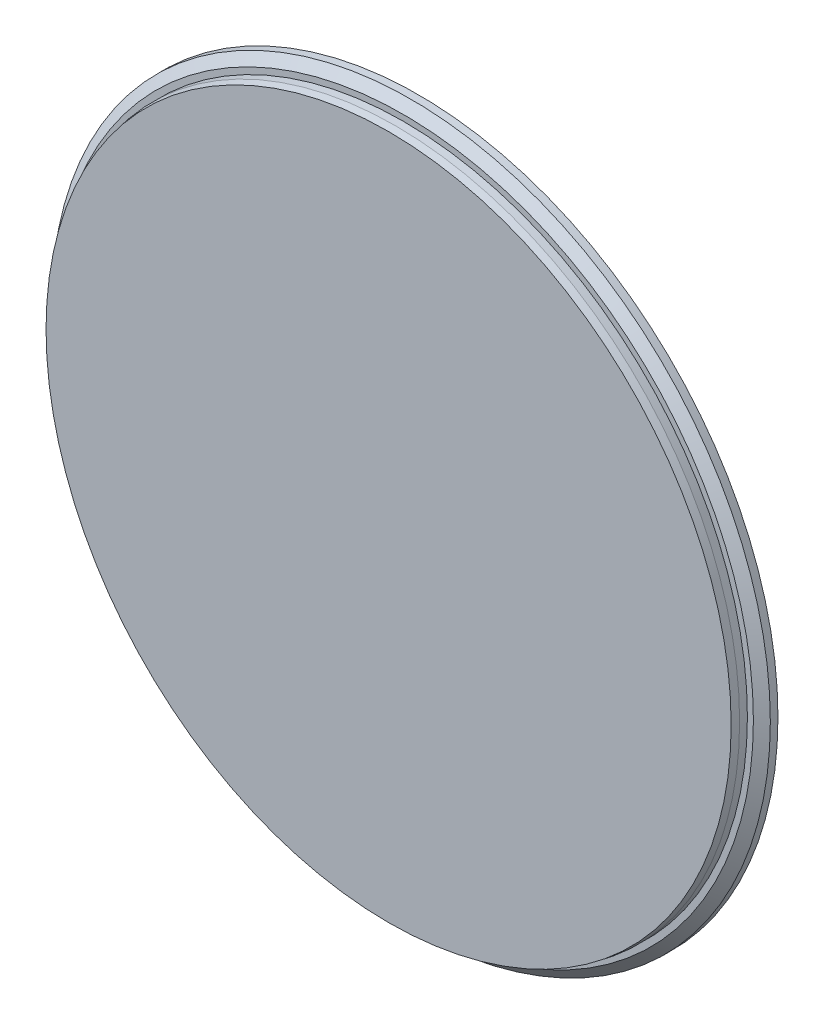
from build123d import *


with BuildPart() as part:
    # Sketch1 → Revolve1 (revolve)
    with BuildSketch(Plane(origin=(0, 0, 0), x_dir=(0, 0, -1), z_dir=(1, 0, 0)), mode=Mode.PRIVATE) as revolve1_sk:
        Polygon((0, 0), (0, 36.314638841), (0.762, 36.449), (1.5875, 36.449), (1.5875, 37.084), (2.36710422, 38.1), (3.175, 38.1), (3.175, 0), align=None)
    revolve(revolve1_sk.sketch.rotate(Axis((0, 0, 7.989183655), (0, 0, -1)), 90), axis=Axis((0, 0, 7.989183655), (0, 0, -1)))


solid = part.part
